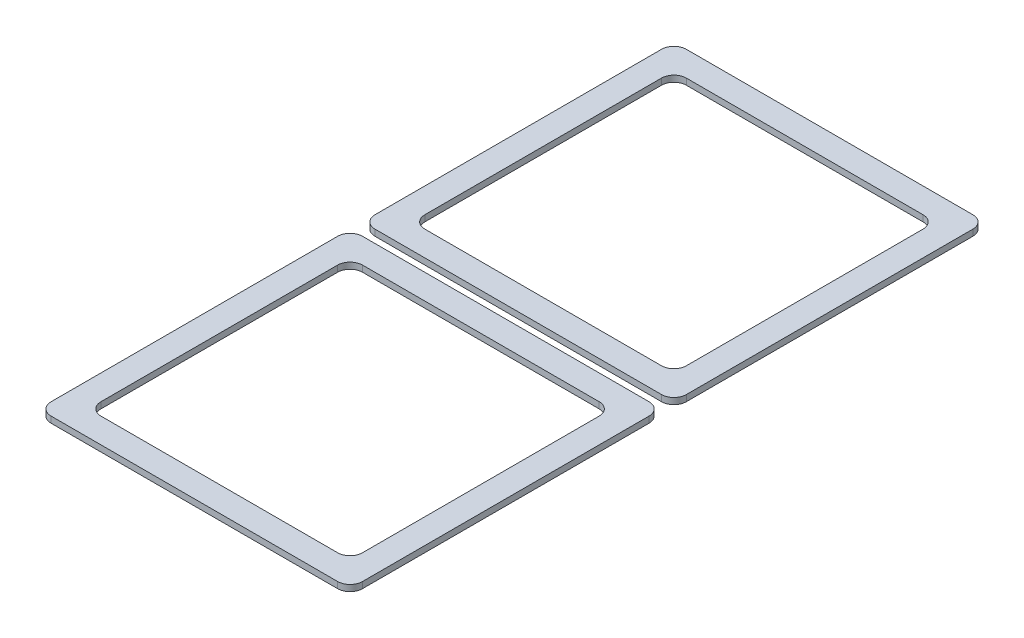
from build123d import *

# Parameters (mm, degrees)
EXTRUDE_1_DEPTH          = 0.5
PATTERN_CIRCULAR_1_COUNT = 2


with BuildPart() as part:
    # 草图1 → 凸台-拉伸1 (new body)
    with BuildSketch(Plane(origin=(0, 0, 0), x_dir=(1, 0, 0), z_dir=(0, 1, 0))):
        with BuildLine():
            Line((-11.5, 0.5), (11.5, 0.5))
            ThreePointArc((11.5, 0.5), (12.207106781, 0.792893219), (12.5, 1.5))
            Line((12.5, 1.5), (12.5, 24.5))
            ThreePointArc((12.5, 24.5), (12.207106781, 25.207106781), (11.5, 25.5))
            Line((11.5, 25.5), (-11.5, 25.5))
            ThreePointArc((-11.5, 25.5), (-12.207106781, 25.207106781), (-12.5, 24.5))
            Line((-12.5, 24.5), (-12.5, 1.5))
            ThreePointArc((-12.5, 1.5), (-12.207106781, 0.792893219), (-11.5, 0.5))
        make_face()
        with BuildLine():
            Line((-9.5, 23.5), (9.5, 23.5))
            ThreePointArc((9.5, 23.5), (10.207106781, 23.207106781), (10.5, 22.5))
            Line((10.5, 22.5), (10.5, 3.5))
            ThreePointArc((10.5, 3.5), (10.207106781, 2.792893219), (9.5, 2.5))
            Line((9.5, 2.5), (-9.5, 2.5))
            ThreePointArc((-9.5, 2.5), (-10.207106781, 2.792893219), (-10.5, 3.5))
            Line((-10.5, 3.5), (-10.5, 22.5))
            ThreePointArc((-10.5, 22.5), (-10.207106781, 23.207106781), (-9.5, 23.5))
        make_face(mode=Mode.SUBTRACT)
    extrude(amount=EXTRUDE_1_DEPTH)


with BuildPart() as pattern_circular_1_1:
    # 阵列(圆周)1: pattern copy
    add(part.part.rotate(Axis((0, 0, 0), (0, 1, 0)), 1 * 360 / PATTERN_CIRCULAR_1_COUNT))


solid = Compound([part.part, pattern_circular_1_1.part])
